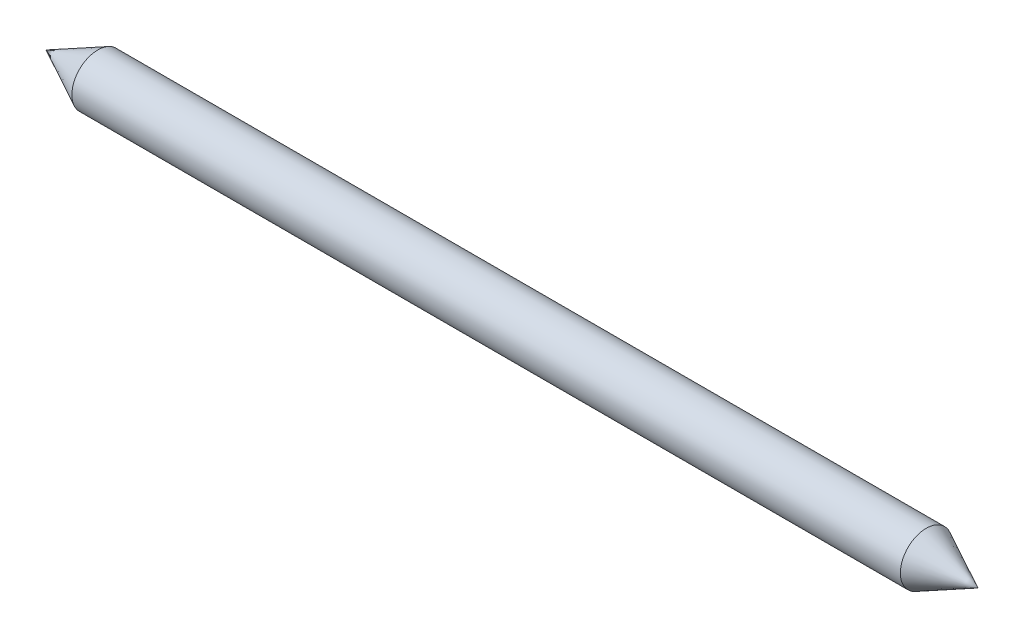
from build123d import *


with BuildPart() as part:
    # Sketch1 → Revolve1 (revolve)
    with BuildSketch(Plane(origin=(0, 0, 0), x_dir=(1, 0, 0), z_dir=(0, 1, 0)), mode=Mode.PRIVATE) as revolve1_sk:
        Polygon((-228.6, 0), (228.6, 0), (203.2, 12.7), (-203.2, 12.7), align=None)
    revolve(revolve1_sk.sketch.rotate(Axis((-228.6, 0, 0), (1, 0, 0)), 180), axis=Axis((-228.6, 0, 0), (1, 0, 0)))


solid = part.part
